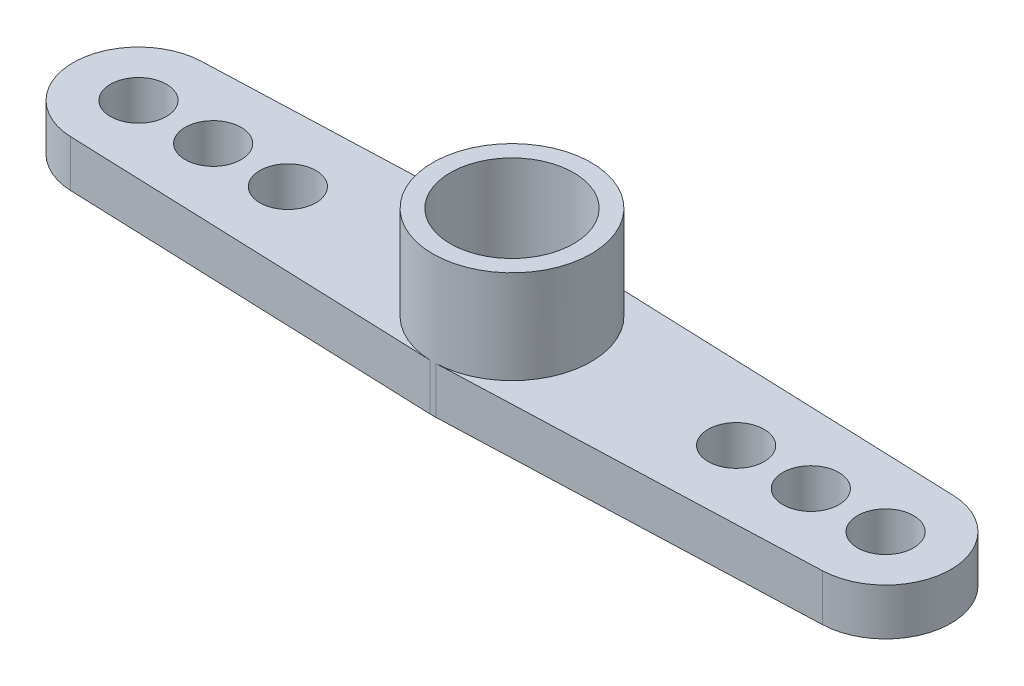
from build123d import *

# Parameters (mm, degrees)
SKETCH_1_R      = 1.5
SKETCH_1_R_2    = 3.3
EXTRUDE_2_DEPTH = 2.5
SKETCH_2_R      = 4.238828267
SKETCH_2_R_2    = 3.3
EXTRUDE_3_DEPTH = 5
SKETCH_3_R      = 3.73192113
SKETCH_3_R_2    = 1.5
EXTRUDE_4_DEPTH = 2.5


with BuildPart() as part:
    # 草图1 → 凸台-拉伸2 (new body)
    with BuildSketch(Plane(origin=(0, 0, 0), x_dir=(1, 0, 0), z_dir=(0, 1, 0))):
        with BuildLine():
            Line((0.156588307, -4.235934983), (20.129294947, -3.497611016))
            ThreePointArc((20.129294947, -3.497611016), (23.5, 0), (20.129294947, 3.497611016))
            Line((20.129294947, 3.497611016), (0.156588307, 4.235934983))
            ThreePointArc((0.156588307, 4.235934983), (0, 4.238828267), (-0.156588307, 4.235934983))
            Line((-0.156588307, 4.235934983), (-20.129294947, 3.497611016))
            ThreePointArc((-20.129294947, 3.497611016), (-23.5, 0), (-20.129294947, -3.497611016))
            Line((-20.129294947, -3.497611016), (-0.156588307, -4.235934983))
            ThreePointArc((-0.156588307, -4.235934983), (0, -4.238828267), (0.156588307, -4.235934983))
        make_face()
        with Locations(Location((-20, 0, 0), (0, 0, 270))):
            Circle(SKETCH_1_R, mode=Mode.SUBTRACT)
        with Locations(Location((-16, 0, 0), (0, 0, 270))):
            Circle(SKETCH_1_R, mode=Mode.SUBTRACT)
        with Locations(Location((-12, 0, 0), (0, 0, 270))):
            Circle(SKETCH_1_R, mode=Mode.SUBTRACT)
        with Locations(Location((0, 0, 0), (0, 0, 270))):
            Circle(SKETCH_1_R_2, mode=Mode.SUBTRACT)
        with Locations(Location((12, 0, 0), (0, 0, 270))):
            Circle(SKETCH_1_R, mode=Mode.SUBTRACT)
        with Locations(Location((16, 0, 0), (0, 0, 270))):
            Circle(SKETCH_1_R, mode=Mode.SUBTRACT)
        with Locations(Location((20, 0, 0), (0, 0, 270))):
            Circle(SKETCH_1_R, mode=Mode.SUBTRACT)
    extrude(amount=EXTRUDE_2_DEPTH)

    # 草图2 → 凸台-拉伸3 (add)
    with BuildSketch(Plane(origin=(0, 2.5, 0), x_dir=(1, 0, 0), z_dir=(0, 1, 0))):
        with Locations(Location((0, 0, 0), (0, 0, 92.117068776))):
            Circle(SKETCH_2_R)
        with Locations(Location((0, 0, 0), (0, 0, 270))):
            Circle(SKETCH_2_R_2, mode=Mode.SUBTRACT)
    extrude(amount=EXTRUDE_3_DEPTH)

    # 草图3 → 凸台-拉伸4 (add)
    with BuildSketch(Plane(origin=(0, 2.5, 0), x_dir=(1, 0, 0), z_dir=(0, 1, 0))):
        Circle(SKETCH_3_R)
        with Locations(Location((0, 0, 0), (0, 0, 270))):
            Circle(SKETCH_3_R_2, mode=Mode.SUBTRACT)
    extrude(amount=-EXTRUDE_4_DEPTH)


solid = part.part
